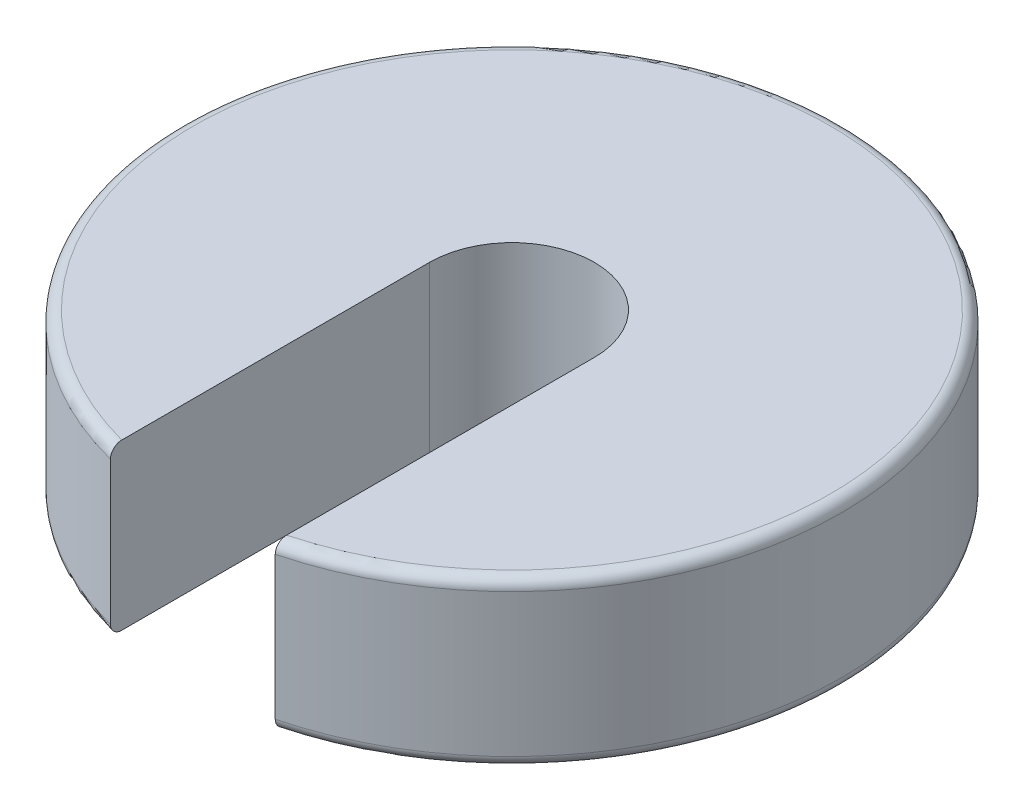
from build123d import *

# Parameters (mm, degrees)
BOSS_EXTRUDE1_DEPTH = 3
FILLET1_R           = 0.2


with BuildPart() as part:
    # Sketch1 → Boss-Extrude1 (new body)
    with BuildSketch(Plane(origin=(0, 0, 0), x_dir=(1, 0, 0), z_dir=(0, 1, 0))):
        with BuildLine():
            Line((-1.5, 0), (-1.5, -5.809475019))
            ThreePointArc((-1.5, -5.809475019), (0, 6), (1.5, -5.809475019))
            Line((1.5, -5.809475019), (1.5, 0))
            ThreePointArc((1.5, 0), (0, 1.5), (-1.5, 0))
        make_face()
    extrude(amount=BOSS_EXTRUDE1_DEPTH)

    # Fillet1
    fillet1_edges = [part.edges().sort_by_distance(p)[0] for p in [
        (0, 3, -6),
        (0, 0, -6),
    ]]
    fillet(fillet1_edges, radius=FILLET1_R)


solid = part.part
